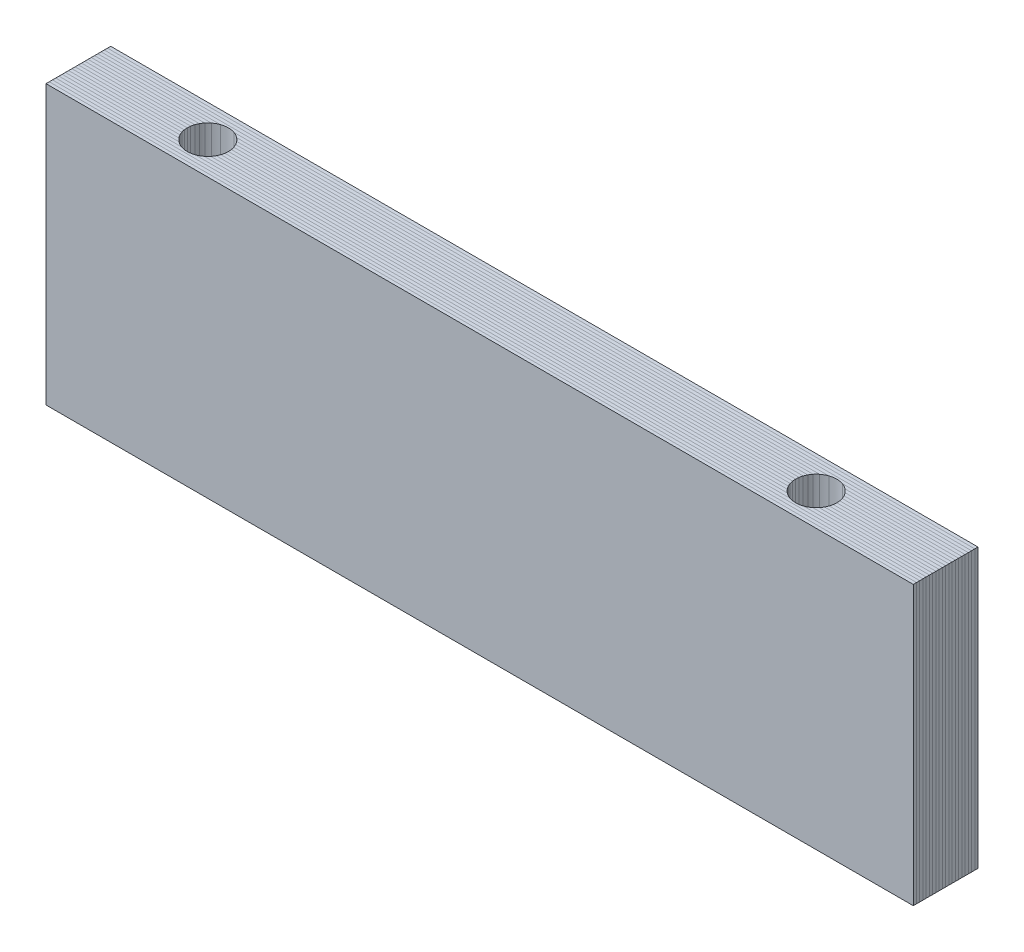
from build123d import *

# Parameters (mm, degrees)
ESBO_O1_W                                    = 134
ESBO_O1_H                                    = 43
RESSALTO_EXTRUS_O1_DEPTH                     = 0.5
ESBO_O2_W                                    = 134
ESBO_O2_H                                    = 43
RESSALTO_EXTRUS_O3_DEPTH                     = 0.5
ESBO_O4_W                                    = 134
ESBO_O4_H                                    = 43
RESSALTO_EXTRUS_O4_DEPTH                     = 0.5
ESBO_O5_W                                    = 134
ESBO_O5_H                                    = 43
RESSALTO_EXTRUS_O5_DEPTH                     = 0.5
ESBO_O6_W                                    = 134
ESBO_O6_H                                    = 43
RESSALTO_EXTRUS_O6_DEPTH                     = 0.5
ESBO_O7_W                                    = 134
ESBO_O7_H                                    = 43
RESSALTO_EXTRUS_O7_DEPTH                     = 0.5
ESBO_O8_W                                    = 134
ESBO_O8_H                                    = 43
RESSALTO_EXTRUS_O8_DEPTH                     = 0.5
ESBO_O9_W                                    = 134
ESBO_O9_H                                    = 43
RESSALTO_EXTRUS_O9_DEPTH                     = 0.5
ESBO_O10_W                                   = 134
ESBO_O10_H                                   = 43
RESSALTO_EXTRUS_O10_DEPTH                    = 0.5
ESBO_O11_W                                   = 134
ESBO_O11_H                                   = 43
RESSALTO_EXTRUS_O11_DEPTH                    = 0.5
ESBO_O12_W                                   = 134
ESBO_O12_H                                   = 43
RESSALTO_EXTRUS_O12_DEPTH                    = 0.5
ESBO_O13_W                                   = 134
ESBO_O13_H                                   = 43
RESSALTO_EXTRUS_O13_DEPTH                    = 0.5
ESBO_O14_W                                   = 134
ESBO_O14_H                                   = 43
RESSALTO_EXTRUS_O14_DEPTH                    = 0.5
ESBO_O15_W                                   = 134
ESBO_O15_H                                   = 43
RESSALTO_EXTRUS_O15_DEPTH                    = 0.5
ESBO_O16_W                                   = 134
ESBO_O16_H                                   = 43
RESSALTO_EXTRUS_O16_DEPTH                    = 0.5
ESBO_O17_W                                   = 134
ESBO_O17_H                                   = 43
RESSALTO_EXTRUS_O17_DEPTH                    = 0.5
ESBO_O18_W                                   = 134
ESBO_O18_H                                   = 43
RESSALTO_EXTRUS_O18_DEPTH                    = 0.5
ESBO_O19_W                                   = 134
ESBO_O19_H                                   = 43
RESSALTO_EXTRUS_O19_DEPTH                    = 0.5
ESBO_O20_W                                   = 134
ESBO_O20_H                                   = 43
RESSALTO_EXTRUS_O20_DEPTH                    = 0.5
ESBO_O21_W                                   = 134
ESBO_O21_H                                   = 43
RESSALTO_EXTRUS_O21_DEPTH                    = 0.5
BROCA_DE_ROSQUEAR_PARA_TARRAXA_DE_M3_2_COUNT = 2
BROCA_DE_ROSQUEAR_PARA_TARRAXA_DE_M3_2_PITCH = 94


with BuildPart() as part:
    # Esboço1 → Ressalto-extrusão1 (new body)
    with BuildSketch(Plane.XY):
        with Locations((-67, 21.5)):
            Rectangle(ESBO_O1_W, ESBO_O1_H)
    extrude(amount=RESSALTO_EXTRUS_O1_DEPTH)


with BuildPart() as body_2:
    # Esboço2 → Ressalto-extrusão3 (new body)
    with BuildSketch(Plane.XY.offset(0.5)):
        with Locations((-67, 21.5)):
            Rectangle(ESBO_O2_W, ESBO_O2_H)
    extrude(amount=RESSALTO_EXTRUS_O3_DEPTH)


with BuildPart() as body_3:
    # Esboço4 → Ressalto-extrusão4 (new body)
    with BuildSketch(Plane.XY.offset(1)):
        with Locations((-67, 21.5)):
            Rectangle(ESBO_O4_W, ESBO_O4_H)
    extrude(amount=RESSALTO_EXTRUS_O4_DEPTH)


with BuildPart() as body_4:
    # Esboço5 → Ressalto-extrusão5 (new body)
    with BuildSketch(Plane.XY.offset(1.5)):
        with Locations((-67, 21.5)):
            Rectangle(ESBO_O5_W, ESBO_O5_H)
    extrude(amount=RESSALTO_EXTRUS_O5_DEPTH)


with BuildPart() as body_5:
    # Esboço6 → Ressalto-extrusão6 (new body)
    with BuildSketch(Plane.XY.offset(2)):
        with Locations((-67, 21.5)):
            Rectangle(ESBO_O6_W, ESBO_O6_H)
    extrude(amount=RESSALTO_EXTRUS_O6_DEPTH)


with BuildPart() as body_6:
    # Esboço7 → Ressalto-extrusão7 (new body)
    with BuildSketch(Plane.XY.offset(2.5)):
        with Locations((-67, 21.5)):
            Rectangle(ESBO_O7_W, ESBO_O7_H)
    extrude(amount=RESSALTO_EXTRUS_O7_DEPTH)


with BuildPart() as body_7:
    # Esboço8 → Ressalto-extrusão8 (new body)
    with BuildSketch(Plane.XY.offset(3)):
        with Locations((-67, 21.5)):
            Rectangle(ESBO_O8_W, ESBO_O8_H)
    extrude(amount=RESSALTO_EXTRUS_O8_DEPTH)


with BuildPart() as body_8:
    # Esboço9 → Ressalto-extrusão9 (new body)
    with BuildSketch(Plane.XY.offset(3.5)):
        with Locations((-67, 21.5)):
            Rectangle(ESBO_O9_W, ESBO_O9_H)
    extrude(amount=RESSALTO_EXTRUS_O9_DEPTH)


with BuildPart() as body_9:
    # Esboço10 → Ressalto-extrusão10 (new body)
    with BuildSketch(Plane.XY.offset(4)):
        with Locations((-67, 21.5)):
            Rectangle(ESBO_O10_W, ESBO_O10_H)
    extrude(amount=RESSALTO_EXTRUS_O10_DEPTH)


with BuildPart() as body_10:
    # Esboço11 → Ressalto-extrusão11 (new body)
    with BuildSketch(Plane.XY.offset(4.5)):
        with Locations((-67, 21.5)):
            Rectangle(ESBO_O11_W, ESBO_O11_H)
    extrude(amount=RESSALTO_EXTRUS_O11_DEPTH)


with BuildPart() as body_11:
    # Esboço12 → Ressalto-extrusão12 (new body)
    with BuildSketch(Plane.XY.offset(5)):
        with Locations((-67, 21.5)):
            Rectangle(ESBO_O12_W, ESBO_O12_H)
    extrude(amount=RESSALTO_EXTRUS_O12_DEPTH)


with BuildPart() as body_12:
    # Esboço13 → Ressalto-extrusão13 (new body)
    with BuildSketch(Plane.XY.offset(5.5)):
        with Locations((-67, 21.5)):
            Rectangle(ESBO_O13_W, ESBO_O13_H)
    extrude(amount=RESSALTO_EXTRUS_O13_DEPTH)


with BuildPart() as body_13:
    # Esboço14 → Ressalto-extrusão14 (new body)
    with BuildSketch(Plane.XY.offset(6)):
        with Locations((-67, 21.5)):
            Rectangle(ESBO_O14_W, ESBO_O14_H)
    extrude(amount=RESSALTO_EXTRUS_O14_DEPTH)


with BuildPart() as body_14:
    # Esboço15 → Ressalto-extrusão15 (new body)
    with BuildSketch(Plane.XY.offset(6.5)):
        with Locations((-67, 21.5)):
            Rectangle(ESBO_O15_W, ESBO_O15_H)
    extrude(amount=RESSALTO_EXTRUS_O15_DEPTH)


with BuildPart() as body_15:
    # Esboço16 → Ressalto-extrusão16 (new body)
    with BuildSketch(Plane.XY.offset(7)):
        with Locations((-67, 21.5)):
            Rectangle(ESBO_O16_W, ESBO_O16_H)
    extrude(amount=RESSALTO_EXTRUS_O16_DEPTH)


with BuildPart() as body_16:
    # Esboço17 → Ressalto-extrusão17 (new body)
    with BuildSketch(Plane.XY.offset(7.5)):
        with Locations((-67, 21.5)):
            Rectangle(ESBO_O17_W, ESBO_O17_H)
    extrude(amount=RESSALTO_EXTRUS_O17_DEPTH)


with BuildPart() as body_17:
    # Esboço18 → Ressalto-extrusão18 (new body)
    with BuildSketch(Plane.XY.offset(8)):
        with Locations((-67, 21.5)):
            Rectangle(ESBO_O18_W, ESBO_O18_H)
    extrude(amount=RESSALTO_EXTRUS_O18_DEPTH)


with BuildPart() as body_18:
    # Esboço19 → Ressalto-extrusão19 (new body)
    with BuildSketch(Plane.XY.offset(8.5)):
        with Locations((-67, 21.5)):
            Rectangle(ESBO_O19_W, ESBO_O19_H)
    extrude(amount=RESSALTO_EXTRUS_O19_DEPTH)


with BuildPart() as body_19:
    # Esboço20 → Ressalto-extrusão20 (new body)
    with BuildSketch(Plane.XY.offset(9)):
        with Locations((-67, 21.5)):
            Rectangle(ESBO_O20_W, ESBO_O20_H)
    extrude(amount=RESSALTO_EXTRUS_O20_DEPTH)


with BuildPart() as body_20:
    # Esboço21 → Ressalto-extrusão21 (new body)
    with BuildSketch(Plane.XY.offset(9.5)):
        with Locations((-67, 21.5)):
            Rectangle(ESBO_O21_W, ESBO_O21_H)
    extrude(amount=RESSALTO_EXTRUS_O21_DEPTH)


with BuildPart() as broca_de_rosquear_para_tarraxa_de_m3x0_5_tool:
    # Esboço24 → Broca de rosquear para tarraxa de M3x0.51 (revolve)
    with BuildSketch(Plane(origin=(-114, 43, 5), x_dir=(0, 0, 1), z_dir=(1, 0, 0))):
        Polygon((0, 0), (0, 23.49), (3.175, 21.582267535), (3.175, 0), align=None)
    broca_de_rosquear_para_tarraxa_de_m3x0_5 = revolve(axis=Axis((-114, 49.35, 5), (0, -1, 0)))


with BuildPart() as body_4_1:
    add(body_4.part)

    # Broca de rosquear para tarraxa de M3x0.51: cut by broca_de_rosquear_para_tarraxa_de_m3x0_5_tool
    add(broca_de_rosquear_para_tarraxa_de_m3x0_5_tool.part, mode=Mode.SUBTRACT)


with BuildPart() as body_5_1:
    add(body_5.part)

    # Broca de rosquear para tarraxa de M3x0.51: cut by broca_de_rosquear_para_tarraxa_de_m3x0_5_tool
    add(broca_de_rosquear_para_tarraxa_de_m3x0_5_tool.part, mode=Mode.SUBTRACT)


with BuildPart() as body_6_1:
    add(body_6.part)

    # Broca de rosquear para tarraxa de M3x0.51: cut by broca_de_rosquear_para_tarraxa_de_m3x0_5_tool
    add(broca_de_rosquear_para_tarraxa_de_m3x0_5_tool.part, mode=Mode.SUBTRACT)


with BuildPart() as body_7_1:
    add(body_7.part)

    # Broca de rosquear para tarraxa de M3x0.51: cut by broca_de_rosquear_para_tarraxa_de_m3x0_5_tool
    add(broca_de_rosquear_para_tarraxa_de_m3x0_5_tool.part, mode=Mode.SUBTRACT)


with BuildPart() as body_8_1:
    add(body_8.part)

    # Broca de rosquear para tarraxa de M3x0.51: cut by broca_de_rosquear_para_tarraxa_de_m3x0_5_tool
    add(broca_de_rosquear_para_tarraxa_de_m3x0_5_tool.part, mode=Mode.SUBTRACT)


with BuildPart() as body_9_1:
    add(body_9.part)

    # Broca de rosquear para tarraxa de M3x0.51: cut by broca_de_rosquear_para_tarraxa_de_m3x0_5_tool
    add(broca_de_rosquear_para_tarraxa_de_m3x0_5_tool.part, mode=Mode.SUBTRACT)


with BuildPart() as body_10_1:
    add(body_10.part)

    # Broca de rosquear para tarraxa de M3x0.51: cut by broca_de_rosquear_para_tarraxa_de_m3x0_5_tool
    add(broca_de_rosquear_para_tarraxa_de_m3x0_5_tool.part, mode=Mode.SUBTRACT)


with BuildPart() as body_11_1:
    add(body_11.part)

    # Broca de rosquear para tarraxa de M3x0.51: cut by broca_de_rosquear_para_tarraxa_de_m3x0_5_tool
    add(broca_de_rosquear_para_tarraxa_de_m3x0_5_tool.part, mode=Mode.SUBTRACT)


with BuildPart() as body_12_1:
    add(body_12.part)

    # Broca de rosquear para tarraxa de M3x0.51: cut by broca_de_rosquear_para_tarraxa_de_m3x0_5_tool
    add(broca_de_rosquear_para_tarraxa_de_m3x0_5_tool.part, mode=Mode.SUBTRACT)


with BuildPart() as body_13_1:
    add(body_13.part)

    # Broca de rosquear para tarraxa de M3x0.51: cut by broca_de_rosquear_para_tarraxa_de_m3x0_5_tool
    add(broca_de_rosquear_para_tarraxa_de_m3x0_5_tool.part, mode=Mode.SUBTRACT)


with BuildPart() as body_14_1:
    add(body_14.part)

    # Broca de rosquear para tarraxa de M3x0.51: cut by broca_de_rosquear_para_tarraxa_de_m3x0_5_tool
    add(broca_de_rosquear_para_tarraxa_de_m3x0_5_tool.part, mode=Mode.SUBTRACT)


with BuildPart() as body_15_1:
    add(body_15.part)

    # Broca de rosquear para tarraxa de M3x0.51: cut by broca_de_rosquear_para_tarraxa_de_m3x0_5_tool
    add(broca_de_rosquear_para_tarraxa_de_m3x0_5_tool.part, mode=Mode.SUBTRACT)


with BuildPart() as body_16_1:
    add(body_16.part)

    # Broca de rosquear para tarraxa de M3x0.51: cut by broca_de_rosquear_para_tarraxa_de_m3x0_5_tool
    add(broca_de_rosquear_para_tarraxa_de_m3x0_5_tool.part, mode=Mode.SUBTRACT)


with BuildPart() as body_17_1:
    add(body_17.part)

    # Broca de rosquear para tarraxa de M3x0.51: cut by broca_de_rosquear_para_tarraxa_de_m3x0_5_tool
    add(broca_de_rosquear_para_tarraxa_de_m3x0_5_tool.part, mode=Mode.SUBTRACT)


with BuildPart() as broca_de_rosquear_para_tarraxa_de_m3_2_tool:
    # Broca de rosquear para tarraxa de M3 2: Broca de rosquear para tarraxa de M3x0.51 ×2
    with Locations(*[(i * BROCA_DE_ROSQUEAR_PARA_TARRAXA_DE_M3_2_PITCH, 0, 0) for i in range(1, BROCA_DE_ROSQUEAR_PARA_TARRAXA_DE_M3_2_COUNT)]):
        add(broca_de_rosquear_para_tarraxa_de_m3x0_5)


with BuildPart() as body_4_2:
    add(body_4_1.part)

    # Broca de rosquear para tarraxa de M3 2: cut by broca_de_rosquear_para_tarraxa_de_m3_2_tool
    add(broca_de_rosquear_para_tarraxa_de_m3_2_tool.part, mode=Mode.SUBTRACT)


with BuildPart() as body_5_2:
    add(body_5_1.part)

    # Broca de rosquear para tarraxa de M3 2: cut by broca_de_rosquear_para_tarraxa_de_m3_2_tool
    add(broca_de_rosquear_para_tarraxa_de_m3_2_tool.part, mode=Mode.SUBTRACT)


with BuildPart() as body_6_2:
    add(body_6_1.part)

    # Broca de rosquear para tarraxa de M3 2: cut by broca_de_rosquear_para_tarraxa_de_m3_2_tool
    add(broca_de_rosquear_para_tarraxa_de_m3_2_tool.part, mode=Mode.SUBTRACT)


with BuildPart() as body_7_2:
    add(body_7_1.part)

    # Broca de rosquear para tarraxa de M3 2: cut by broca_de_rosquear_para_tarraxa_de_m3_2_tool
    add(broca_de_rosquear_para_tarraxa_de_m3_2_tool.part, mode=Mode.SUBTRACT)


with BuildPart() as body_8_2:
    add(body_8_1.part)

    # Broca de rosquear para tarraxa de M3 2: cut by broca_de_rosquear_para_tarraxa_de_m3_2_tool
    add(broca_de_rosquear_para_tarraxa_de_m3_2_tool.part, mode=Mode.SUBTRACT)


with BuildPart() as body_9_2:
    add(body_9_1.part)

    # Broca de rosquear para tarraxa de M3 2: cut by broca_de_rosquear_para_tarraxa_de_m3_2_tool
    add(broca_de_rosquear_para_tarraxa_de_m3_2_tool.part, mode=Mode.SUBTRACT)


with BuildPart() as body_10_2:
    add(body_10_1.part)

    # Broca de rosquear para tarraxa de M3 2: cut by broca_de_rosquear_para_tarraxa_de_m3_2_tool
    add(broca_de_rosquear_para_tarraxa_de_m3_2_tool.part, mode=Mode.SUBTRACT)


with BuildPart() as body_11_2:
    add(body_11_1.part)

    # Broca de rosquear para tarraxa de M3 2: cut by broca_de_rosquear_para_tarraxa_de_m3_2_tool
    add(broca_de_rosquear_para_tarraxa_de_m3_2_tool.part, mode=Mode.SUBTRACT)


with BuildPart() as body_12_2:
    add(body_12_1.part)

    # Broca de rosquear para tarraxa de M3 2: cut by broca_de_rosquear_para_tarraxa_de_m3_2_tool
    add(broca_de_rosquear_para_tarraxa_de_m3_2_tool.part, mode=Mode.SUBTRACT)


with BuildPart() as body_13_2:
    add(body_13_1.part)

    # Broca de rosquear para tarraxa de M3 2: cut by broca_de_rosquear_para_tarraxa_de_m3_2_tool
    add(broca_de_rosquear_para_tarraxa_de_m3_2_tool.part, mode=Mode.SUBTRACT)


with BuildPart() as body_14_2:
    add(body_14_1.part)

    # Broca de rosquear para tarraxa de M3 2: cut by broca_de_rosquear_para_tarraxa_de_m3_2_tool
    add(broca_de_rosquear_para_tarraxa_de_m3_2_tool.part, mode=Mode.SUBTRACT)


with BuildPart() as body_15_2:
    add(body_15_1.part)

    # Broca de rosquear para tarraxa de M3 2: cut by broca_de_rosquear_para_tarraxa_de_m3_2_tool
    add(broca_de_rosquear_para_tarraxa_de_m3_2_tool.part, mode=Mode.SUBTRACT)


with BuildPart() as body_16_2:
    add(body_16_1.part)

    # Broca de rosquear para tarraxa de M3 2: cut by broca_de_rosquear_para_tarraxa_de_m3_2_tool
    add(broca_de_rosquear_para_tarraxa_de_m3_2_tool.part, mode=Mode.SUBTRACT)


with BuildPart() as body_17_2:
    add(body_17_1.part)

    # Broca de rosquear para tarraxa de M3 2: cut by broca_de_rosquear_para_tarraxa_de_m3_2_tool
    add(broca_de_rosquear_para_tarraxa_de_m3_2_tool.part, mode=Mode.SUBTRACT)


solid = Compound([part.part, body_2.part, body_3.part, body_18.part, body_19.part, body_20.part, body_4_2.part, body_5_2.part, body_6_2.part, body_7_2.part, body_8_2.part, body_9_2.part, body_10_2.part, body_11_2.part, body_12_2.part, body_13_2.part, body_14_2.part, body_15_2.part, body_16_2.part, body_17_2.part])
